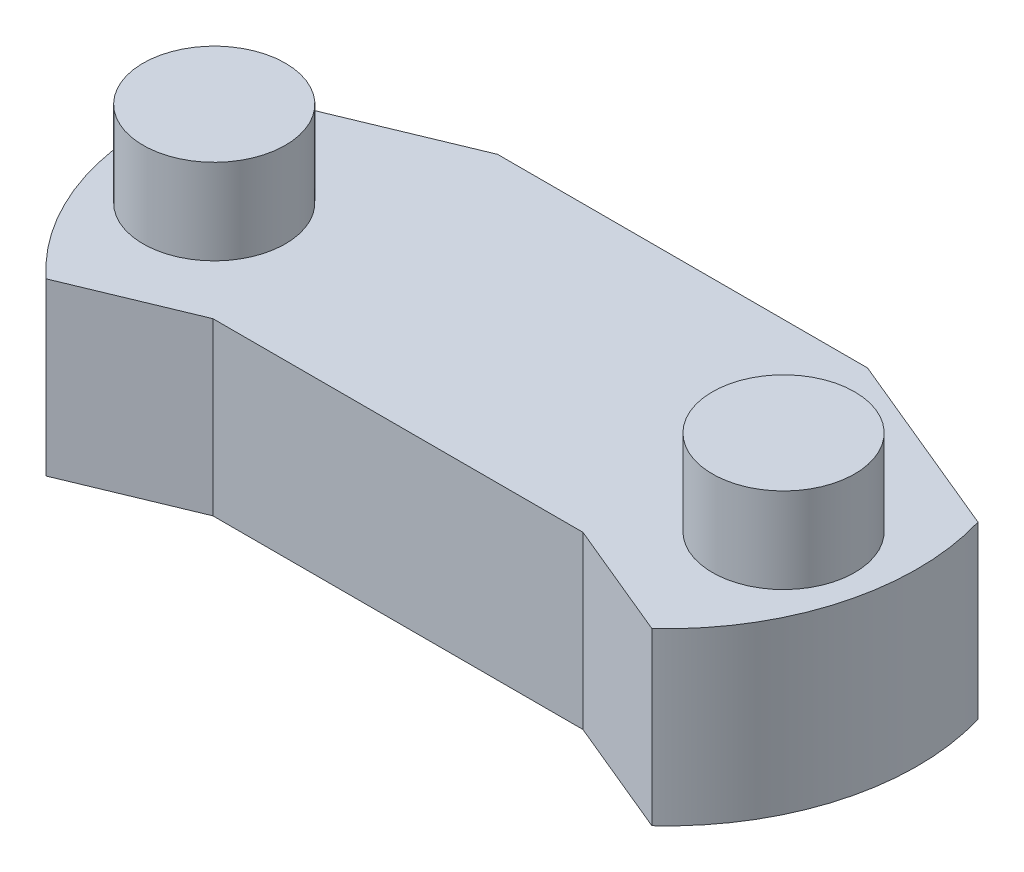
from build123d import *

# Parameters (mm, degrees)
SKETCH2_W           = 32.5
SKETCH2_H           = 50
BOSS_EXTRUDE1_DEPTH = 30
FILLET1_R           = 3
SKETCH3_R           = 12.5
BOSS_EXTRUDE2_DEPTH = 45
CUT_EXTRUDE1_DEPTH  = 92.572762002


with BuildPart() as part:
    # Sketch2 → Boss-Extrude1 (new body)
    with BuildSketch(Plane(origin=(0, 0, 0), x_dir=(1, 0, 0), z_dir=(0, 1, 0))):
        with BuildLine():
            Line((-33.026431533, 15.07807147), (-21.486968519, 36.349341511))
            Line((-21.486968519, 36.349341511), (-56.486968519, 21.832088794))
            Line((-56.486968519, 21.832088794), (-47.76505884, 12.989879738))
            ThreePointArc((-47.76505884, 12.989879738), (-40.740475826, 16.467112533), (-33.026431533, 15.07807147))
        make_face()
        with BuildLine():
            Line((-47.76505884, 12.989879738), (-56.486968519, 21.832088794))
            Line((-56.486968519, 21.832088794), (-56.486968519, -28.167911206))
            Line((-56.486968519, -28.167911206), (-44.947505506, -6.896641164))
            ThreePointArc((-44.947505506, -6.896641164), (-51.3633659, 2.337207846), (-47.76505884, 12.989879738))
        make_face()
        with BuildLine():
            Line((-56.486968519, -28.167911206), (-21.486968519, -13.650658489))
            Line((-21.486968519, -13.650658489), (-30.208878198, -4.808449432))
            ThreePointArc((-30.208878198, -4.808449432), (-37.233461212, -8.285682228), (-44.947505506, -6.896641164))
            Line((-44.947505506, -6.896641164), (-56.486968519, -28.167911206))
        make_face()
        with BuildLine():
            Line((-21.486968519, -13.650658489), (-21.486968519, 36.349341511))
            Line((-21.486968519, 36.349341511), (-33.026431533, 15.07807147))
            ThreePointArc((-33.026431533, 15.07807147), (-28.245536763, 10.483808601), (-26.486968519, 4.090715153))
            ThreePointArc((-26.486968519, 4.090715153), (-27.454923405, -0.732347722), (-30.208878198, -4.808449432))
            Line((-30.208878198, -4.808449432), (-21.486968519, -13.650658489))
        make_face()
        with Locations((-5.236968519, 11.349341511)):
            Rectangle(SKETCH2_W, SKETCH2_H)
        with BuildLine():
            Line((55.052494494, 15.07807147), (43.513031481, 36.349341511))
            Line((43.513031481, 36.349341511), (43.513031481, -13.650658489))
            Line((43.513031481, -13.650658489), (52.23494116, -4.808449432))
            ThreePointArc((52.23494116, -4.808449432), (48.6366341, 5.84422246), (55.052494494, 15.07807147))
        make_face()
        with BuildLine():
            Line((78.513031481, 21.832088794), (43.513031481, 36.349341511))
            Line((43.513031481, 36.349341511), (55.052494494, 15.07807147))
            ThreePointArc((55.052494494, 15.07807147), (62.766538788, 16.467112533), (69.791121802, 12.989879738))
            Line((69.791121802, 12.989879738), (78.513031481, 21.832088794))
        make_face()
        with BuildLine():
            Line((78.513031481, -28.167911206), (78.513031481, 21.832088794))
            Line((78.513031481, 21.832088794), (69.791121802, 12.989879738))
            ThreePointArc((69.791121802, 12.989879738), (72.545076595, 8.913778028), (73.513031481, 4.090715153))
            ThreePointArc((73.513031481, 4.090715153), (71.754463237, -2.302378295), (66.973568467, -6.896641164))
            Line((66.973568467, -6.896641164), (78.513031481, -28.167911206))
        make_face()
        with BuildLine():
            Line((52.23494116, -4.808449432), (43.513031481, -13.650658489))
            Line((43.513031481, -13.650658489), (78.513031481, -28.167911206))
            Line((78.513031481, -28.167911206), (66.973568467, -6.896641164))
            ThreePointArc((66.973568467, -6.896641164), (59.259524174, -8.285682228), (52.23494116, -4.808449432))
        make_face()
        with Locations((27.263031481, 11.349341511)):
            Rectangle(SKETCH2_W, SKETCH2_H)
    extrude(amount=BOSS_EXTRUDE1_DEPTH)

    # Fillet1
    fillet1_edges = [part.edges().sort_by_distance(p)[0] for p in [
        (-56.486968519, 15, 28.167911206),
        (-56.486968519, 15, -21.832088794),
        (78.513031481, 15, -21.832088794),
        (78.513031481, 15, 28.167911206),
    ]]
    fillet(fillet1_edges, radius=FILLET1_R)

    # Sketch3 → Boss-Extrude2 (add)
    with BuildSketch(Plane(origin=(0, 0, 0), x_dir=(-1, 0, 0), z_dir=(0, -1, 0))):
        with Locations(Location((38.986968519, 4.090715153, 0), (0, 0, 90))):
            Circle(SKETCH3_R)
        with Locations(Location((-61.013031481, 4.090715153, 0), (0, 0, 90))):
            Circle(SKETCH3_R)
    extrude(amount=-BOSS_EXTRUDE2_DEPTH)

    # Sketch4 → Cut-Extrude1 (cut, through all)
    with BuildSketch(Plane(origin=(0, 30, 0), x_dir=(1, 0, 0), z_dir=(0, 1, 0))):
        with BuildLine():
            ThreePointArc((-56.486968519, -23.675749532), (-55.153077724, -26.17056017), (-52.337581774, -26.446834177))
            Line((-52.337581774, -26.446834177), (-42.18410533, -22.235388934))
            ThreePointArc((-42.18410533, -22.235388934), (-54.833584995, -1.601840339), (-54.636355265, 22.59968366))
            ThreePointArc((-54.636355265, 22.59968366), (-55.981779157, 21.494708219), (-56.486968519, 19.828599015))
            Line((-56.486968519, 19.828599015), (-56.486968519, -23.675749532))
        make_face()
        with BuildLine():
            Line((64.210168291, -22.235388934), (74.363644735, -26.446834177))
            ThreePointArc((74.363644735, -26.446834177), (77.179140685, -26.17056017), (78.513031481, -23.675749532))
            Line((78.513031481, -23.675749532), (78.513031481, 19.828599015))
            ThreePointArc((78.513031481, 19.828599015), (78.007842119, 21.494708219), (76.662418226, 22.59968366))
            ThreePointArc((76.662418226, 22.59968366), (76.859647957, -1.601840339), (64.210168291, -22.235388934))
        make_face()
    extrude(amount=-CUT_EXTRUDE1_DEPTH, mode=Mode.SUBTRACT)


solid = part.part
